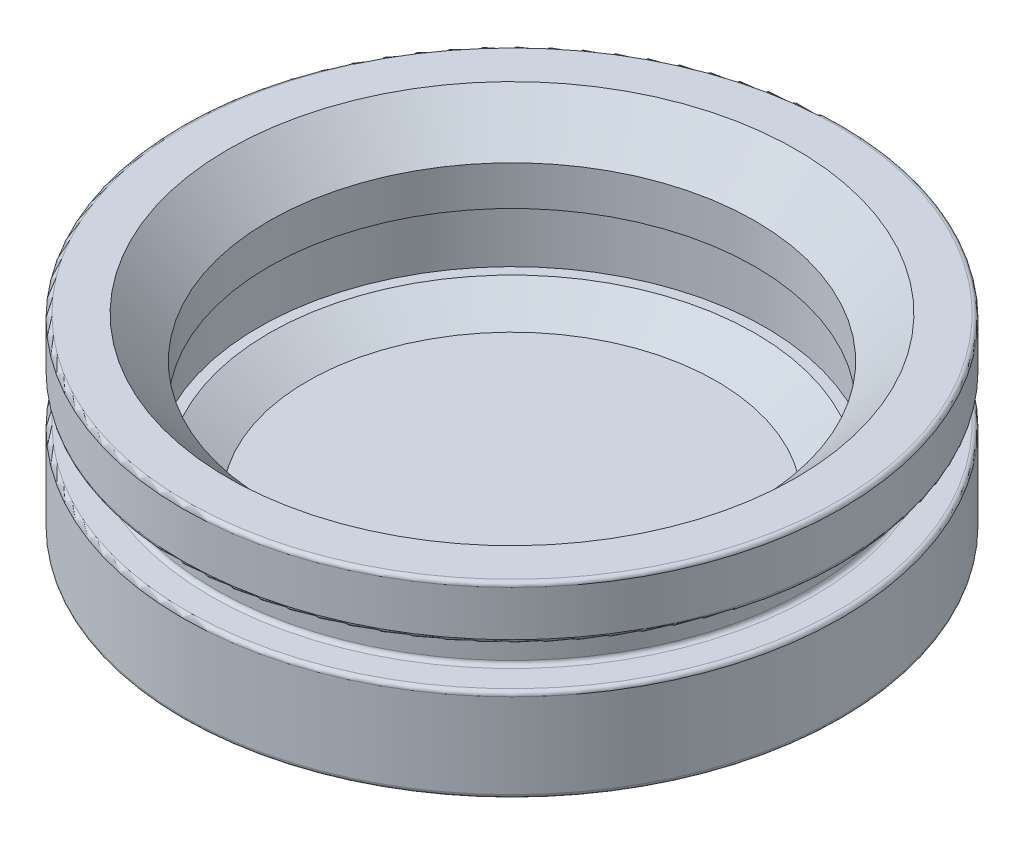
from build123d import *

# Parameters (mm, degrees)
CHAMFER1_SIZE = 1.27
FILLET1_R     = 0.127


with BuildPart() as part:
    # Sketch1 → Revolve1 (revolve)
    with BuildSketch(Plane.XY):
        Polygon((0, 0), (10.16, 4.417391304), (10.16, 7.239), (9.144, 7.239), (9.144, 8.509), (10.16, 8.509), (10.16, 10.16), (7.493, 10.16), (7.493, 7.6708), (7.8105, 7.6708), (7.8105, 5.8928), (7.493, 5.8928), (6.305159556, 5.207), (0, 5.207), align=None)
    revolve(axis=Axis((0, 0, 0), (0, 1, 0)))

    # Chamfer1
    chamfer1_edges = [part.edges().sort_by_distance(p)[0] for p in [
        (-7.493, 10.16, 0),
    ]]
    chamfer(chamfer1_edges, length=CHAMFER1_SIZE)

    # Fillet1
    fillet1_edges = [part.edges().sort_by_distance(p)[0] for p in [
        (-10.16, 10.16, 0),
        (-10.16, 8.509, 0),
        (-9.144, 8.509, 0),
        (-9.144, 7.239, 0),
        (-10.16, 7.239, 0),
        (-10.16, 4.417391304, 0),
    ]]
    fillet(fillet1_edges, radius=FILLET1_R)


solid = part.part
